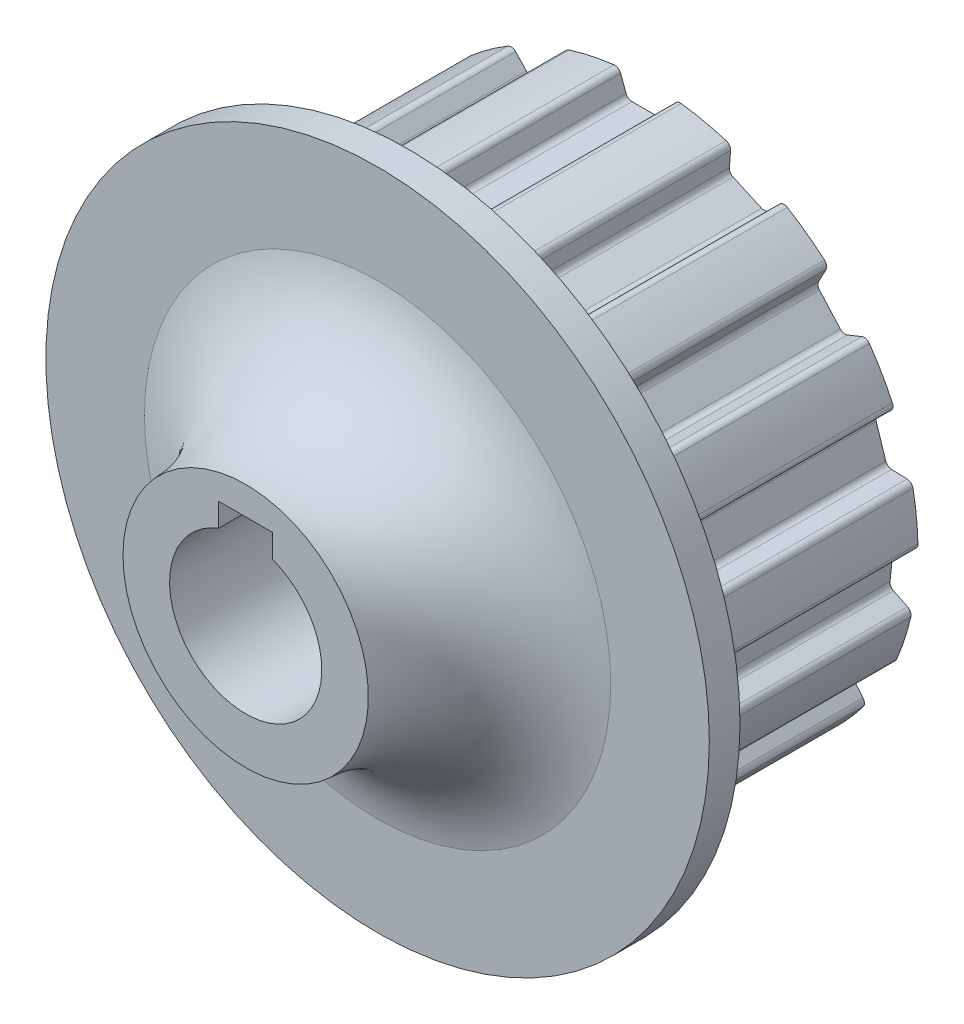
from build123d import *

# Parameters (mm, degrees)
BOSS_EXTRUDE1_DEPTH      = 7.25
BOSS_EXTRUDE1_DEPTH_BACK = 7.25
SKETCH7_R                = 22.031647778
CUT_EXTRUDE3_DEPTH       = 36.98314894
CUT_EXTRUDE3_DEPTH_BACK  = 36.98314894
SKETCH15_R               = 8.008120878
SKETCH15_R_2             = 2.25
BOSS_EXTRUDE2_DEPTH      = 5.5
SKETCH16_R               = 5
CUT_EXTRUDE4_DEPTH       = 3
BOSS_EXTRUDE3_START      = 7.5
SKETCH17_R               = 22.031647778
SKETCH17_R_2             = 5
BOSS_EXTRUDE3_DEPTH      = 7.5
CUT_EXTRUDE2_DEPTH       = 36.98314894
CUT_EXTRUDE2_DEPTH_BACK  = 36.98314894
FILLET2_R                = 0.51
BOSS_EXTRUDE4_START      = 2.5
SKETCH18_R               = 27.031647778
SKETCH18_R_2             = 22.031647778
SKETCH18_R_3             = 5
BOSS_EXTRUDE4_DEPTH      = 2.5
BOSS_EXTRUDE5_START      = -2.5
SKETCH19_R               = 27.031647778
SKETCH19_R_2             = 19
BOSS_EXTRUDE5_DEPTH      = 2.5
CUT_EXTRUDE5_DEPTH       = 52.999831377
SKETCH21_R               = 8.008120878
SKETCH21_R_2             = 6.2
SKETCH21_R_3             = 2.25
BOSS_EXTRUDE6_DEPTH      = 2.5
SKETCH21_4_R             = 8.008120878
SKETCH21_4_R_2           = 6.2
BOSS_EXTRUDE7_DEPTH      = 12
CUT_EXTRUDE6_DEPTH       = 43.254230122
CUT_EXTRUDE6_DEPTH_BACK  = 43.254230122
SKETCH22_W               = 54.063295556
SKETCH22_H               = 2.5
SKETCH23_R               = 1.75
CUT_EXTRUDE7_DEPTH       = 6
CUT_EXTRUDE8_DEPTH       = 3
SKETCH25_R               = 1.75
BOSS_EXTRUDE8_DEPTH      = 0.2


with BuildPart() as part:
    # Sketch7 → Boss-Extrude1 (new, two sides: drawn at the far end of the back side and taken through both)
    with BuildSketch(Plane.XY.offset(-BOSS_EXTRUDE1_DEPTH_BACK)):
        Circle(SKETCH7_R)
    extrude(amount=BOSS_EXTRUDE1_DEPTH + BOSS_EXTRUDE1_DEPTH_BACK)

    # Sketch14 → Revolve1 (revolve)
    with BuildSketch(Plane(origin=(0, 0, 0), x_dir=(0, 0, -1), z_dir=(1, 0, 0)), mode=Mode.PRIVATE) as revolve1_sk:
        Polygon((-18, 6.739517467), (-18, 0), (0, 0), (0, 19), (-3.355534752, 19), (-11.020158508, 12.583105693), align=None)
        with BuildLine():
            ThreePointArc((-7.25, 19), (-8.580081567, 15.465471544), (-11.020158508, 12.583105693))
            Line((-11.020158508, 12.583105693), (-3.355534752, 19))
            Line((-3.355534752, 19), (-7.25, 19))
        make_face()
        with BuildLine():
            Line((-18, 10), (-18, 6.739517467))
            Line((-18, 6.739517467), (-11.020158508, 12.583105693))
            ThreePointArc((-11.020158508, 12.583105693), (-14.286666254, 10.687865845), (-18, 10))
        make_face()
    revolve(revolve1_sk.sketch.rotate(Axis((0, 0, -36.129595921), (0, 0, 1)), 270), axis=Axis((0, 0, -36.129595921), (0, 0, 1)))

    # Sketch10 → Cut-Extrude3 (cut, two sides: drawn at the far end of the back side and taken through both)
    with BuildSketch(Plane.XY.offset(-CUT_EXTRUDE3_DEPTH_BACK)):
        with BuildLine():
            Line((2.2, 7.7), (-2.2, 7.7))
            Line((-2.2, 7.7), (-2.2, 5.796550698))
            ThreePointArc((-2.2, 5.796550698), (0, 6.2), (2.2, 5.796550698))
            Line((2.2, 5.796550698), (2.2, 7.7))
        make_face()
        with BuildLine():
            ThreePointArc((2.2, 5.796550698), (0, 6.2), (-2.2, 5.796550698))
            Line((-2.2, 5.796550698), (-2.2, 0))
            Line((-2.2, 0), (2.2, 0))
            Line((2.2, 0), (2.2, 5.796550698))
        make_face()
        with BuildLine():
            Line((-2.2, 0), (-2.2, 5.796550698))
            ThreePointArc((-2.2, 5.796550698), (-3.521363372, -5.102940329), (6.2, 0))
            ThreePointArc((6.2, 0), (5.102940329, 3.521363372), (2.2, 5.796550698))
            Line((2.2, 5.796550698), (2.2, 0))
            Line((2.2, 0), (-2.2, 0))
        make_face()
        with BuildLine():
            ThreePointArc((2.2, 5.796550698), (0, 6.2), (-2.2, 5.796550698))
            Line((-2.2, 5.796550698), (-2.2, 0))
            Line((-2.2, 0), (2.2, 0))
            Line((2.2, 0), (2.2, 5.796550698))
        make_face()
        with BuildLine():
            Line((-2.2, 0), (-2.2, 5.796550698))
            ThreePointArc((-2.2, 5.796550698), (-3.521363372, -5.102940329), (6.2, 0))
            ThreePointArc((6.2, 0), (5.102940329, 3.521363372), (2.2, 5.796550698))
            Line((2.2, 5.796550698), (2.2, 0))
            Line((2.2, 0), (-2.2, 0))
        make_face()
    extrude(amount=CUT_EXTRUDE3_DEPTH + CUT_EXTRUDE3_DEPTH_BACK, mode=Mode.SUBTRACT)

    # Sketch15 → Boss-Extrude2 (add)
    with BuildSketch(Plane(origin=(0, 0, -7.25), x_dir=(-1, 0, 0), z_dir=(0, 0, -1))):
        Circle(SKETCH15_R)
        Circle(SKETCH15_R_2, mode=Mode.SUBTRACT)
    extrude(amount=-BOSS_EXTRUDE2_DEPTH)

    # Sketch16 → Cut-Extrude4 (cut)
    with BuildSketch(Plane(origin=(0, 0, -7.25), x_dir=(-1, 0, 0), z_dir=(0, 0, -1))):
        Circle(SKETCH16_R)
    extrude(amount=-CUT_EXTRUDE4_DEPTH, mode=Mode.SUBTRACT)

    # Sketch17 → Boss-Extrude3 (add)
    with BuildSketch(Plane(origin=(0, 0, -7.25), x_dir=(-1, 0, 0), z_dir=(0, 0, -1)).offset(BOSS_EXTRUDE3_START)):
        with Locations(Location((0, 0, 0), (0, 0, 180))):
            Circle(SKETCH17_R)
        Circle(SKETCH17_R_2, mode=Mode.SUBTRACT)
    extrude(amount=-BOSS_EXTRUDE3_DEPTH)

    # Sketch8 → Cut-Extrude2 (cut, two sides: drawn at the far end of the back side and taken through both)
    with BuildSketch(Plane.XY.offset(-CUT_EXTRUDE2_DEPTH_BACK)):
        Polygon((-1.629816853, 19.998625671), (-2.369776385, 22.031647778), (2.369776385, 22.031647778), (1.629816853, 19.998625671), align=None)
        Polygon((6.645262089, 18.932559877), (6.796180007, 21.090786644), (11.125976911, 19.16303686), (9.623085654, 17.606747406), align=None)
        Polygon((13.771314846, 14.592882482), (14.787015134, 16.503136895), (17.958394952, 12.980962779), (15.952435523, 12.170502561), align=None)
        Polygon((18.516182157, 7.729963135), (20.221041008, 9.061944851), (21.68564336, 4.554362304), (19.523464367, 4.629867259), align=None)
        Polygon((20.059433359, -0.469537064), (22.15866519, 0.053860216), (21.663247022, -4.659728787), (19.718708857, -3.711314154), align=None)
        Polygon((18.134226299, -8.587850038), (20.264854855, -8.963537338), (17.89507847, -13.06811044), (16.504409446, -11.410775634), align=None)
        Polygon((13.073446767, -15.221245722), (14.867067016, -16.431057856), (11.032688279, -19.216897077), (10.436347704, -17.137210342), align=None)
        Polygon((5.752149521, -19.222749741), (6.898628226, -21.057499199), (2.262646056, -22.042907629), (2.563746633, -19.900465696), align=None)
        Polygon((-2.563746633, -19.900465696), (-2.262646056, -22.042907629), (-6.898628226, -21.057499199), (-5.752149521, -19.222749741), align=None)
        Polygon((-10.436347704, -17.137210342), (-11.032688279, -19.216897077), (-14.867067016, -16.431057856), (-13.073446767, -15.221245722), align=None)
        Polygon((-16.504409446, -11.410775634), (-17.89507847, -13.06811044), (-20.264854855, -8.963537338), (-18.134226299, -8.587850038), align=None)
        Polygon((-19.718708857, -3.711314154), (-21.663247022, -4.659728787), (-22.15866519, 0.053860216), (-20.059433359, -0.469537064), align=None)
        Polygon((-19.523464367, 4.629867259), (-21.68564336, 4.554362304), (-20.221041008, 9.061944851), (-18.516182157, 7.729963135), align=None)
        Polygon((-15.952435523, 12.170502561), (-17.958394952, 12.980962779), (-14.787015134, 16.503136895), (-13.771314846, 14.592882482), align=None)
        Polygon((-9.623085654, 17.606747406), (-11.125976911, 19.16303686), (-6.796180007, 21.090786644), (-6.645262089, 18.932559877), align=None)
    extrude(amount=CUT_EXTRUDE2_DEPTH + CUT_EXTRUDE2_DEPTH_BACK, mode=Mode.SUBTRACT)

    # Fillet2
    fillet2_edges = [part.edges().sort_by_distance(p)[0] for p in [
        (6.787047671, 20.960188161, -3.75),
        (11.035034049, 19.06886277, -3.75),
        (9.623085654, 17.606747406, -3.75),
        (6.645262089, 18.932559877, -3.75),
        (14.725553141, 16.387543699, -3.75),
        (17.837010461, 12.931920261, -3.75),
        (15.952435523, 12.170502561, -3.75),
        (13.771314846, 14.592882482, -3.75),
        (20.117876696, 8.981344056, -3.75),
        (21.55480572, 4.558931255, -3.75),
        (19.523464367, 4.629867259, -3.75),
        (18.516182157, 7.729963135, -3.75),
        (22.031636605, 0.022188433, -3.75),
        (21.545579251, -4.60233838, -3.75),
        (19.718708857, -3.711314154, -3.75),
        (20.059433359, -0.469537064, -3.75),
        (20.135926394, -8.940803772, -3.75),
        (17.810926394, -12.9678219, -3.75),
        (16.504409446, -11.410775634, -3.75),
        (18.134226299, -8.587850038, -3.75),
        (14.75853158, -16.35784978, -3.75),
        (10.996602556, -19.091051203, -3.75),
        (10.436347704, -17.137210342, -3.75),
        (13.073446767, -15.221245722, -3.75),
        (6.829252579, -20.946474955, -3.75),
        (2.280866235, -21.913264317, -3.75),
        (2.563746633, -19.900465696, -3.75),
        (5.752149521, -19.222749741, -3.75),
        (-2.280866235, -21.913264317, -3.75),
        (-6.829252579, -20.946474955, -3.75),
        (-5.752149521, -19.222749741, -3.75),
        (-2.563746633, -19.900465696, -3.75),
        (-10.996602556, -19.091051203, -3.75),
        (-14.75853158, -16.35784978, -3.75),
        (-13.073446767, -15.221245722, -3.75),
        (-10.436347704, -17.137210342, -3.75),
        (-17.810926394, -12.9678219, -3.75),
        (-20.135926394, -8.940803772, -3.75),
        (-18.134226299, -8.587850038, -3.75),
        (-16.504409446, -11.410775634, -3.75),
        (-21.545579251, -4.60233838, -3.75),
        (-22.031636605, 0.022188433, -3.75),
        (-20.059433359, -0.469537064, -3.75),
        (-19.718708857, -3.711314154, -3.75),
        (-21.55480572, 4.558931255, -3.75),
        (-20.117876696, 8.981344056, -3.75),
        (-18.516182157, 7.729963135, -3.75),
        (-19.523464367, 4.629867259, -3.75),
        (-17.837010461, 12.931920261, -3.75),
        (-14.725553141, 16.387543699, -3.75),
        (-13.771314846, 14.592882482, -3.75),
        (-15.952435523, 12.170502561, -3.75),
        (-11.035034049, 19.06886277, -3.75),
        (-6.787047671, 20.960188161, -3.75),
        (-6.645262089, 18.932559877, -3.75),
        (-9.623085654, 17.606747406, -3.75),
        (-2.325, 21.908625671, -3.75),
        (2.325, 21.908625671, -3.75),
        (1.629816853, 19.998625671, -3.75),
        (-1.629816853, 19.998625671, -3.75),
    ]]
    fillet(fillet2_edges, radius=FILLET2_R)

    # Sketch18 → Boss-Extrude4 (add)
    # profile 1 of 2: a face of its own
    with BuildSketch(Plane(origin=(0, 0, -14.75), x_dir=(-1, 0, 0), z_dir=(0, 0, -1)).offset(BOSS_EXTRUDE4_START)):
        Circle(SKETCH18_R)
        Circle(SKETCH18_R_2, mode=Mode.SUBTRACT)
    # profile 2 of 2: a face of its own
    with BuildSketch(Plane(origin=(0, 0, -14.75), x_dir=(-1, 0, 0), z_dir=(0, 0, -1)).offset(BOSS_EXTRUDE4_START)):
        Circle(SKETCH18_R_2)
        Circle(SKETCH18_R_3, mode=Mode.SUBTRACT)
    extrude(amount=-BOSS_EXTRUDE4_DEPTH)

    # Sketch19 → Boss-Extrude5 (add)
    with BuildSketch(Plane.XY.offset(7.25).offset(BOSS_EXTRUDE5_START)):
        with Locations(Location((0, 0, 0), (0, 0, 180))):
            Circle(SKETCH19_R)
        Circle(SKETCH19_R_2, mode=Mode.SUBTRACT)
    extrude(amount=BOSS_EXTRUDE5_DEPTH)

    # Sketch20 → Cut-Extrude5 (cut, through all)
    with BuildSketch(Plane.XY.offset(18)):
        with BuildLine():
            Line((-2.2, 7.7), (-2.2, 5.796550698))
            ThreePointArc((-2.2, 5.796550698), (0, 6.2), (2.2, 5.796550698))
            Line((2.2, 5.796550698), (2.2, 7.7))
            Line((2.2, 7.7), (-2.2, 7.7))
        make_face()
        with BuildLine():
            ThreePointArc((2.2, 5.796550698), (0, 6.2), (-2.2, 5.796550698))
            ThreePointArc((-2.2, 5.796550698), (-3.521363372, -5.102940329), (6.2, 0))
            ThreePointArc((6.2, 0), (5.102940329, 3.521363372), (2.2, 5.796550698))
        make_face()
    extrude(amount=-CUT_EXTRUDE5_DEPTH, mode=Mode.SUBTRACT)

    # Sketch21 → Boss-Extrude6 (add)
    # profile 1 of 2: a face of its own
    with BuildSketch(Plane.XY.offset(-5.25)):
        Circle(SKETCH21_R)
        Circle(SKETCH21_R_2, mode=Mode.SUBTRACT)
    # profile 2 of 2: a face of its own
    with BuildSketch(Plane.XY.offset(-5.25)):
        Circle(SKETCH21_R_2)
        Circle(SKETCH21_R_3, mode=Mode.SUBTRACT)
    extrude(amount=-BOSS_EXTRUDE6_DEPTH)

    # Sketch21<4> → Boss-Extrude7 (add)
    with BuildSketch(Plane.XY.offset(-5.25)):
        Circle(SKETCH21_4_R)
        Circle(SKETCH21_4_R_2, mode=Mode.SUBTRACT)
    extrude(amount=-BOSS_EXTRUDE7_DEPTH)

    # Sketch22 → Cut-Extrude6 (cut, two sides: drawn at the far end of the back side and taken through both)
    with BuildSketch(Plane(origin=(0, 0, 0), x_dir=(1, 0, 0), z_dir=(0, 1, 0)).offset(-CUT_EXTRUDE6_DEPTH_BACK)):
        with Locations((0, 16)):
            Rectangle(SKETCH22_W, SKETCH22_H)
    extrude(amount=CUT_EXTRUDE6_DEPTH + CUT_EXTRUDE6_DEPTH_BACK, mode=Mode.SUBTRACT)

    # Sketch23 → Cut-Extrude7 (cut)
    with BuildSketch(Plane(origin=(0, 0, -14.75), x_dir=(-1, 0, 0), z_dir=(0, 0, -1))):
        with Locations((0, -13.099312836)):
            Circle(SKETCH23_R)
        with Locations((-11.344337688, 6.549656418)):
            Circle(SKETCH23_R)
        with Locations((11.344337688, 6.549656418)):
            Circle(SKETCH23_R)
    extrude(amount=-CUT_EXTRUDE7_DEPTH, mode=Mode.SUBTRACT)

    # Sketch24 → Cut-Extrude8 (cut)
    with BuildSketch(Plane(origin=(0, 0, -12.25), x_dir=(-1, 0, 0), z_dir=(0, 0, -1))):
        Polygon((-11.344337688, 3.201024857), (-8.444337688, 4.875340637), (-8.444337688, 8.223972199), (-11.344337688, 9.898287979), (-14.244337688, 8.223972199), (-14.244337688, 4.875340637), align=None)
        Polygon((2.9, -14.773628616), (2.9, -11.424997055), (0, -9.750681274), (-2.9, -11.424997055), (-2.9, -14.773628616), (0, -16.447944397), align=None)
        Polygon((11.344337688, 3.201024857), (14.244337688, 4.875340637), (14.244337688, 8.223972199), (11.344337688, 9.898287979), (8.444337688, 8.223972199), (8.444337688, 4.875340637), align=None)
    extrude(amount=-CUT_EXTRUDE8_DEPTH, mode=Mode.SUBTRACT)

    # Sketch25 → Boss-Extrude8 (add)
    with BuildSketch(Plane(origin=(0, 0, -9.25), x_dir=(-1, 0, 0), z_dir=(0, 0, -1))):
        with Locations((0, -13.099312836)):
            Circle(SKETCH25_R)
        with Locations((-11.344337688, 6.549656418)):
            Circle(SKETCH25_R)
        with Locations((11.344337688, 6.549656418)):
            Circle(SKETCH25_R)
    extrude(amount=-BOSS_EXTRUDE8_DEPTH)


solid = part.part
